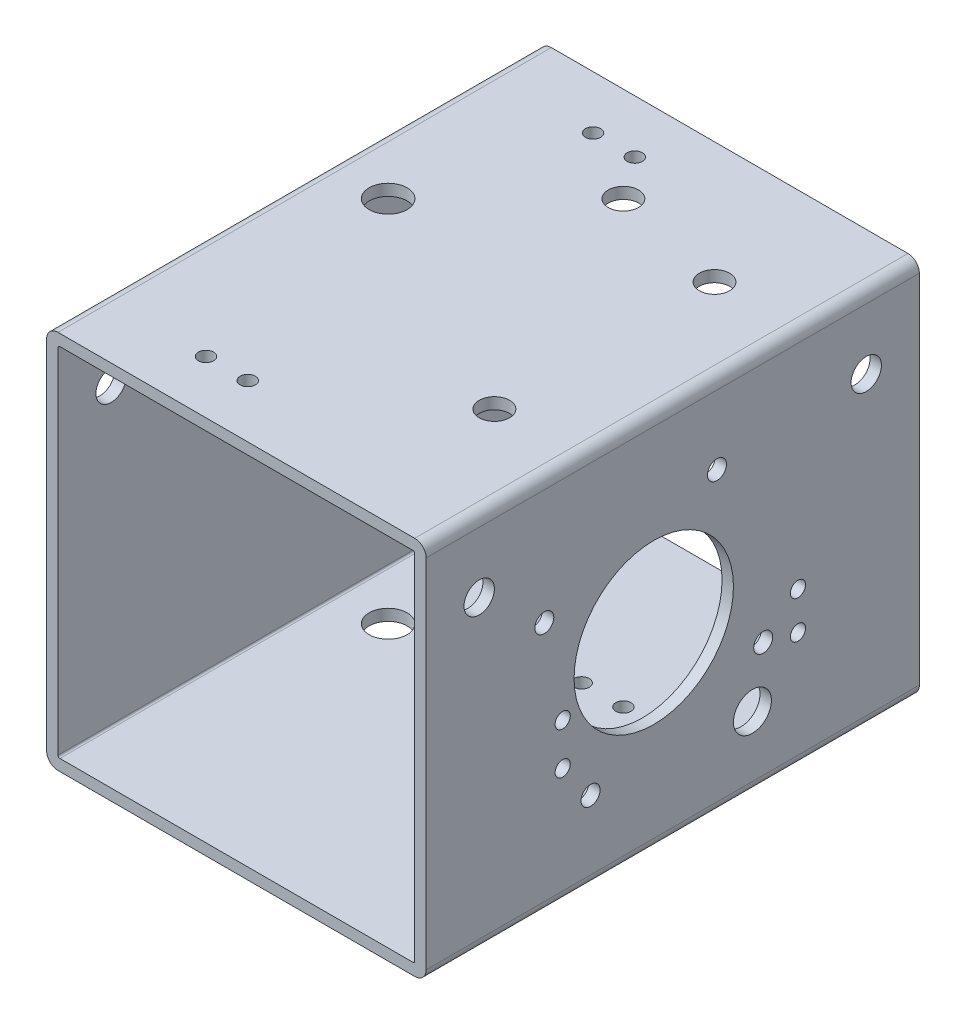
from build123d import *

# Parameters (mm, degrees)
SKETCH1_W                      = 100
SKETCH1_H                      = 100
SKETCH1_W_2                    = 94
SKETCH1_H_2                    = 94
EXTRUDE_THIN1_DEPTH            = 130
FILLET1_R                      = 0.5
FILLET2_R                      = 3
F_8_0_8_DIAMETER_HOLE2_D       = 8
F_8_0_8_DIAMETER_HOLE3_D       = 8
F_10_0_10_DIAMETER_HOLE1_D     = 10
F_10_0_10_DIAMETER_HOLE2_D     = 10
F_21_0_21_DIAMETER_HOLE1_D     = 42
F_21_0_21_DIAMETER_HOLE1_DEPTH = 3
F_5_0_5_DIAMETER_HOLE1_D       = 5
F_5_0_5_DIAMETER_HOLE1_DEPTH   = 3
F_8_0_8_DIAMETER_HOLE5_D       = 8
F_8_0_8_DIAMETER_HOLE5_DEPTH   = 3
CUT_EXTRUDE1_REACH             = 173.464
SKETCH34_R                     = 2
SKETCH35_R                     = 2
CUT_EXTRUDE2_DEPTH             = 10
SKETCH36_R                     = 2
CUT_EXTRUDE3_DEPTH             = 10
SKETCH37_R                     = 2
CUT_EXTRUDE4_DEPTH             = 10
SKETCH38_R                     = 3.1
CUT_EXTRUDE5_DEPTH             = 10
SKETCH39_R                     = 3.1
CUT_EXTRUDE6_DEPTH             = 10


with BuildPart() as part:
    # Sketch1 → Extrude-Thin1 (new body)
    with BuildSketch(Plane.XY):
        Rectangle(SKETCH1_W, SKETCH1_H)
        Rectangle(SKETCH1_W_2, SKETCH1_H_2, mode=Mode.SUBTRACT)
    extrude(amount=EXTRUDE_THIN1_DEPTH)

    # Fillet1
    fillet1_edges = [part.edges().sort_by_distance(p)[0] for p in [
        (47, -47, 65),
        (47, 47, 65),
        (-47, 47, 65),
        (-47, -47, 65),
    ]]
    fillet(fillet1_edges, radius=FILLET1_R)

    # Fillet2
    fillet2_edges = [part.edges().sort_by_distance(p)[0] for p in [
        (50, -50, 65),
        (-50, -50, 65),
        (-50, 50, 65),
        (50, 50, 65),
    ]]
    fillet(fillet2_edges, radius=FILLET2_R)

    # Ø8.0 (8) Diameter Hole2 (through all)
    with Locations(Plane(origin=(0, 50, 0), x_dir=(1, 0, 0), z_dir=(0, 1, 0))):
        with Locations((28, -32), (28, -90)):
            Hole(F_8_0_8_DIAMETER_HOLE2_D / 2)

    # Ø8.0 (8) Diameter Hole3 (through all)
    with Locations(Plane(origin=(50, 0, 0), x_dir=(0, 0, -1), z_dir=(1, 0, 0))):
        with Locations((-14, 31), (-116, 31)):
            Hole(F_8_0_8_DIAMETER_HOLE3_D / 2)

    # Ø10.0 (10) Diameter Hole1 (through all)
    with Locations(Plane(origin=(0, 50, 0), x_dir=(1, 0, 0), z_dir=(0, 1, 0))):
        with Locations((-34, -56)):
            Hole(F_10_0_10_DIAMETER_HOLE1_D / 2)

    # Ø10.0 (10) Diameter Hole2 (through all)
    with Locations(Plane(origin=(50, 0, 0), x_dir=(0, 0, -1), z_dir=(1, 0, 0))):
        with Locations((-44, -31)):
            Hole(F_10_0_10_DIAMETER_HOLE2_D / 2)

    # Ø21.0 (21) Diameter Hole1
    with Locations(Plane(origin=(50, 0, 0), x_dir=(0, 0, -1), z_dir=(1, 0, 0))):
        with Locations((-70, 0)):
            Hole(F_21_0_21_DIAMETER_HOLE1_D / 2, depth=F_21_0_21_DIAMETER_HOLE1_DEPTH)

    # Ø5.0 (5) Diameter Hole1
    with Locations(Plane(origin=(50, 0, 0), x_dir=(0, 0, -1), z_dir=(1, 0, 0))):
        with Locations((-41.157258279, -16.652364697), (-53.347635303, 28.842741721), (-98.842741721, 16.652364697), (-86.652364697, -28.842741721)):
            Hole(F_5_0_5_DIAMETER_HOLE1_D / 2, depth=F_5_0_5_DIAMETER_HOLE1_DEPTH)

    # Ø8.0 (8) Diameter Hole5
    with Locations(Plane(origin=(0, 50, 0), x_dir=(1, 0, 0), z_dir=(0, 1, 0))):
        with Locations((-3, -25)):
            Hole(F_8_0_8_DIAMETER_HOLE5_D / 2, depth=F_8_0_8_DIAMETER_HOLE5_DEPTH)

    # Sketch34 → Cut-Extrude1 (cut, up to next)
    with BuildSketch(Plane(origin=(0, 50, 0), x_dir=(1, 0, 0), z_dir=(0, 1, 0)), mode=Mode.PRIVATE) as cut_extrude1_sk1:
        with Locations(Location((-22, -14, 0), (0, 0, 270))):
            Circle(SKETCH34_R)
    cut_extrude1_tool1 = extrude(cut_extrude1_sk1.sketch, amount=-CUT_EXTRUDE1_REACH, mode=Mode.PRIVATE) & part.part
    # Sketch34 → Cut-Extrude1 (cut, up to next)
    with BuildSketch(Plane(origin=(0, 50, 0), x_dir=(1, 0, 0), z_dir=(0, 1, 0)), mode=Mode.PRIVATE) as cut_extrude1_sk2:
        with Locations(Location((-11, -14, 0), (0, 0, 270))):
            Circle(SKETCH34_R)
    cut_extrude1_tool2 = extrude(cut_extrude1_sk2.sketch, amount=-CUT_EXTRUDE1_REACH, mode=Mode.PRIVATE) & part.part
    # Sketch34 → Cut-Extrude1 (cut, up to next)
    with BuildSketch(Plane(origin=(0, 50, 0), x_dir=(1, 0, 0), z_dir=(0, 1, 0)), mode=Mode.PRIVATE) as cut_extrude1_sk3:
        with Locations(Location((-11, -116, 0), (0, 0, 90))):
            Circle(SKETCH34_R)
    cut_extrude1_tool3 = extrude(cut_extrude1_sk3.sketch, amount=-CUT_EXTRUDE1_REACH, mode=Mode.PRIVATE) & part.part
    # Sketch34 → Cut-Extrude1 (cut, up to next)
    with BuildSketch(Plane(origin=(0, 50, 0), x_dir=(1, 0, 0), z_dir=(0, 1, 0)), mode=Mode.PRIVATE) as cut_extrude1_sk4:
        with Locations(Location((-22, -116, 0), (0, 0, 90))):
            Circle(SKETCH34_R)
    cut_extrude1_tool4 = extrude(cut_extrude1_sk4.sketch, amount=-CUT_EXTRUDE1_REACH, mode=Mode.PRIVATE) & part.part
    add(cut_extrude1_tool1.solids().sort_by_distance((-22, 50, 14))[0], mode=Mode.SUBTRACT)
    add(cut_extrude1_tool2.solids().sort_by_distance((-11, 50, 14))[0], mode=Mode.SUBTRACT)
    add(cut_extrude1_tool3.solids().sort_by_distance((-11, 50, 116))[0], mode=Mode.SUBTRACT)
    add(cut_extrude1_tool4.solids().sort_by_distance((-22, 50, 116))[0], mode=Mode.SUBTRACT)

    # Sketch35 → Cut-Extrude2 (cut)
    with BuildSketch(Plane.XZ.offset(50)):
        with Locations(Location((16, 44, 0), (0, 0, 270))):
            Circle(SKETCH35_R)
        with Locations(Location((5, 44, 0), (0, 0, 270))):
            Circle(SKETCH35_R)
    extrude(amount=-CUT_EXTRUDE2_DEPTH, mode=Mode.SUBTRACT)

    # Sketch36 → Cut-Extrude3 (cut)
    with BuildSketch(Plane.ZY.offset(50)):
        with Locations(Location((56, 19, 0), (0, 0, 270))):
            Circle(SKETCH36_R)
        with Locations(Location((56, 8, 0), (0, 0, 270))):
            Circle(SKETCH36_R)
    extrude(amount=-CUT_EXTRUDE3_DEPTH, mode=Mode.SUBTRACT)

    # Sketch37 → Cut-Extrude4 (cut)
    with BuildSketch(Plane(origin=(50, 0, 0), x_dir=(0, 0, -1), z_dir=(1, 0, 0))):
        with Locations(Location((-94, -19, 0), (0, 0, 90))):
            Circle(SKETCH37_R)
        with Locations(Location((-32, -19, 0), (0, 0, 90))):
            Circle(SKETCH37_R)
        with Locations(Location((-94, -8, 0), (0, 0, 90))):
            Circle(SKETCH37_R)
        with Locations(Location((-32, -9.079681112, 0), (0, 0, 90))):
            Circle(SKETCH37_R)
    extrude(amount=-CUT_EXTRUDE4_DEPTH, mode=Mode.SUBTRACT)

    # Sketch38 → Cut-Extrude5 (cut)
    with BuildSketch(Plane.ZY.offset(50)):
        with Locations(Location((56, 35, 0), (0, 0, 270))):
            Circle(SKETCH38_R)
        with Locations(Location((56, -15, 0), (0, 0, 270))):
            Circle(SKETCH38_R)
    extrude(amount=-CUT_EXTRUDE5_DEPTH, mode=Mode.SUBTRACT)

    # Sketch39 → Cut-Extrude6 (cut)
    with BuildSketch(Plane.XZ.offset(50)):
        with Locations(Location((-20, 44, 0), (0, 0, 270))):
            Circle(SKETCH39_R)
        with Locations(Location((35, 44, 0), (0, 0, 270))):
            Circle(SKETCH39_R)
    extrude(amount=-CUT_EXTRUDE6_DEPTH, mode=Mode.SUBTRACT)


solid = part.part
